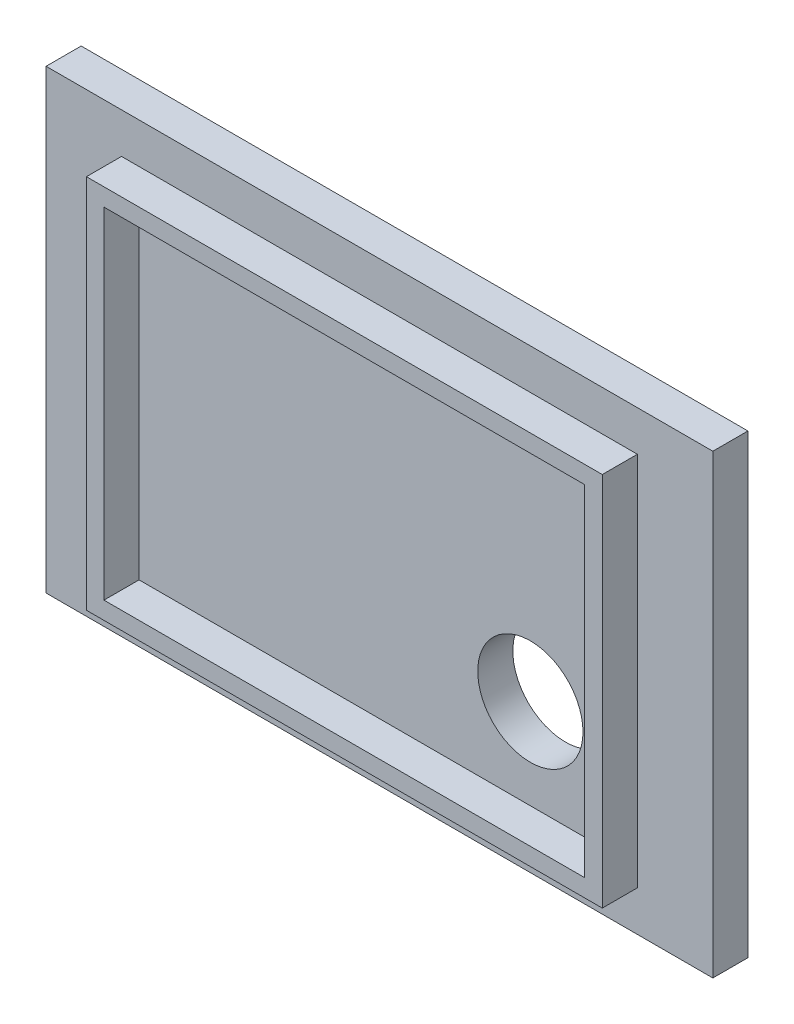
from build123d import *

# Parameters (mm, degrees)
SKETCH1_W           = 38
SKETCH1_H           = 26
BOSS_EXTRUDE1_DEPTH = 2
SKETCH4_W           = 29.4
SKETCH4_H           = 21.4
SKETCH4_W_2         = 27.4
SKETCH4_H_2         = 19.4
BOSS_EXTRUDE2_DEPTH = 2
SKETCH5_R           = 3
CUT_EXTRUDE1_DEPTH  = 2


with BuildPart() as part:
    # Sketch1 → Boss-Extrude1 (new body)
    with BuildSketch(Plane.XY):
        Rectangle(SKETCH1_W, SKETCH1_H)
    extrude(amount=BOSS_EXTRUDE1_DEPTH)

    # Sketch4 → Boss-Extrude2 (add)
    with BuildSketch(Plane.XY.offset(2)):
        Rectangle(SKETCH4_W, SKETCH4_H)
        Rectangle(SKETCH4_W_2, SKETCH4_H_2, mode=Mode.SUBTRACT)
    extrude(amount=BOSS_EXTRUDE2_DEPTH)

    # Sketch5 → Cut-Extrude1 (cut)
    with BuildSketch(Plane.XY.offset(2)):
        with Locations((8.600842855, -4.556950786)):
            Circle(SKETCH5_R)
    extrude(amount=-CUT_EXTRUDE1_DEPTH, mode=Mode.SUBTRACT)


solid = part.part
